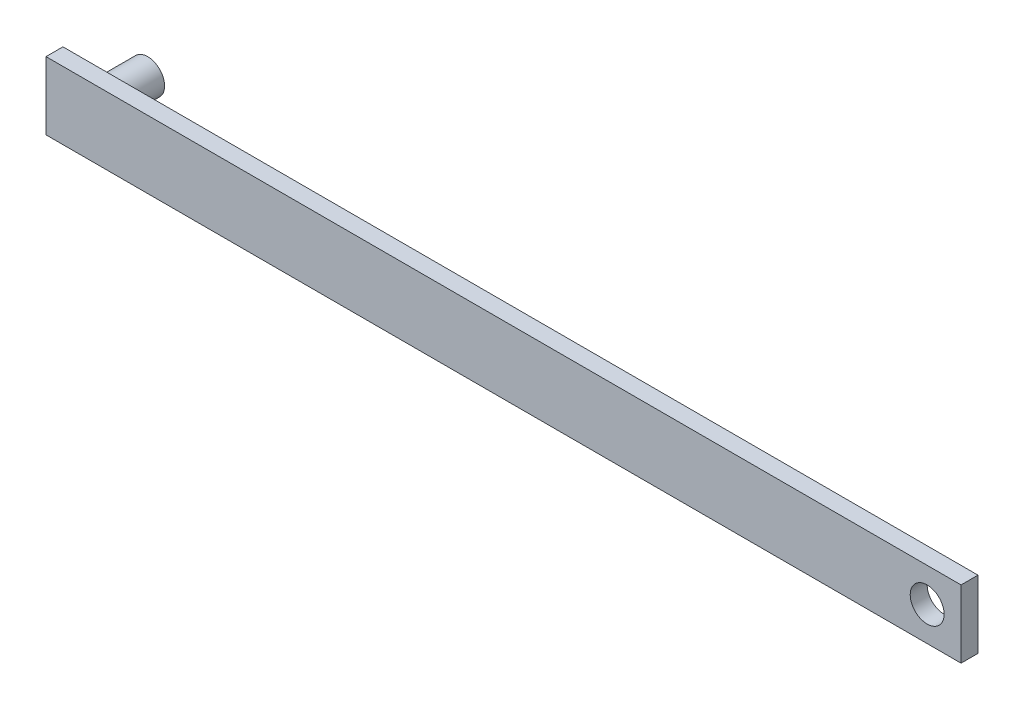
from build123d import *

# Parameters (mm, degrees)
SKETCH1_W           = 270
SKETCH1_H           = 20
BOSS_EXTRUDE1_DEPTH = 5
SKETCH2_R           = 5
CUT_EXTRUDE1_DEPTH  = 5
SKETCH3_R           = 5
BOSS_EXTRUDE2_DEPTH = 15


with BuildPart() as part:
    # Sketch1 → Boss-Extrude1 (new body)
    with BuildSketch(Plane.XY):
        Rectangle(SKETCH1_W, SKETCH1_H)
    extrude(amount=BOSS_EXTRUDE1_DEPTH)

    # Sketch2 → Cut-Extrude1 (cut)
    with BuildSketch(Plane(origin=(0, 0, 0), x_dir=(-1, 0, 0), z_dir=(0, 0, -1))):
        with Locations((-125, 0)):
            Circle(SKETCH2_R)
    extrude(amount=-CUT_EXTRUDE1_DEPTH, mode=Mode.SUBTRACT)

    # Sketch3 → Boss-Extrude2 (add)
    with BuildSketch(Plane(origin=(0, 0, 0), x_dir=(-1, 0, 0), z_dir=(0, 0, -1))):
        with Locations(Location((125, 0, 0), (0, 0, 180))):
            Circle(SKETCH3_R)
    extrude(amount=BOSS_EXTRUDE2_DEPTH)


solid = part.part
